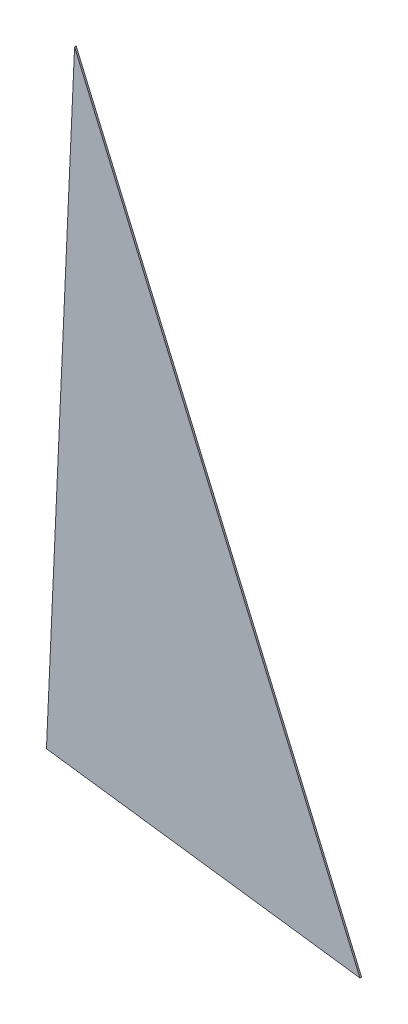
from build123d import *

# Parameters (mm, degrees)
BOSS_EXTRUDE3_DEPTH = 1.5
CUT_EXTRUDE1_DEPTH  = 10


with BuildPart() as part:
    # Sketch2 → Boss-Extrude3 (new body)
    with BuildSketch(Plane.XY):
        Polygon((90.110168233, 286.954641753), (356.729366406, -333.045358247), (56.208258707, -462.278740131), align=None)
    extrude(amount=BOSS_EXTRUDE3_DEPTH)

    # Sketch3 → Cut-Extrude1 (cut)
    with BuildSketch(Plane(origin=(0, 0, 0), x_dir=(-1, 0, 0), z_dir=(0, 0, -1))):
        Polygon((-356.729366406, -333.045358247), (-63.822168281, -294.011073229), (-56.208258707, -462.278740131), align=None)
    extrude(amount=-CUT_EXTRUDE1_DEPTH, mode=Mode.SUBTRACT)


solid = part.part
